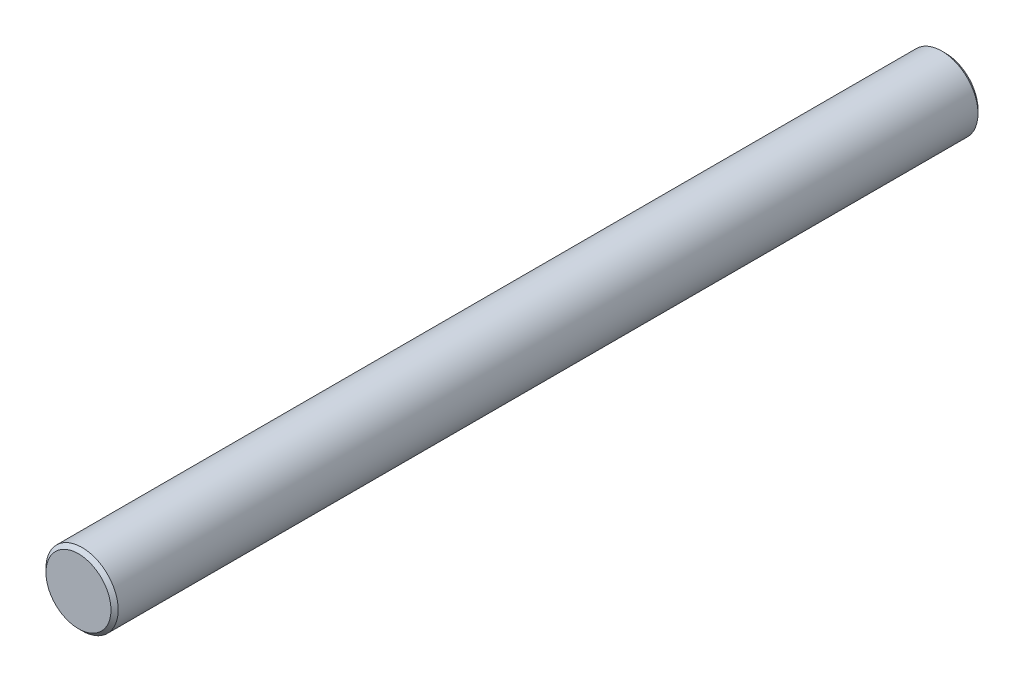
from build123d import *

# Parameters (mm, degrees)
SKETCH1_R           = 2.5
BOSS_EXTRUDE1_DEPTH = 60
CHAMFER1_SIZE       = 0.25


with BuildPart() as part:
    # Sketch1 → Boss-Extrude1 (new body)
    with BuildSketch(Plane.XY):
        Circle(SKETCH1_R)
    extrude(amount=BOSS_EXTRUDE1_DEPTH)

    # Chamfer1
    chamfer1_edges = [part.edges().sort_by_distance(p)[0] for p in [
        (-2.5, 0, 0),
        (-2.5, 0, 60),
    ]]
    chamfer(chamfer1_edges, length=CHAMFER1_SIZE)


solid = part.part
